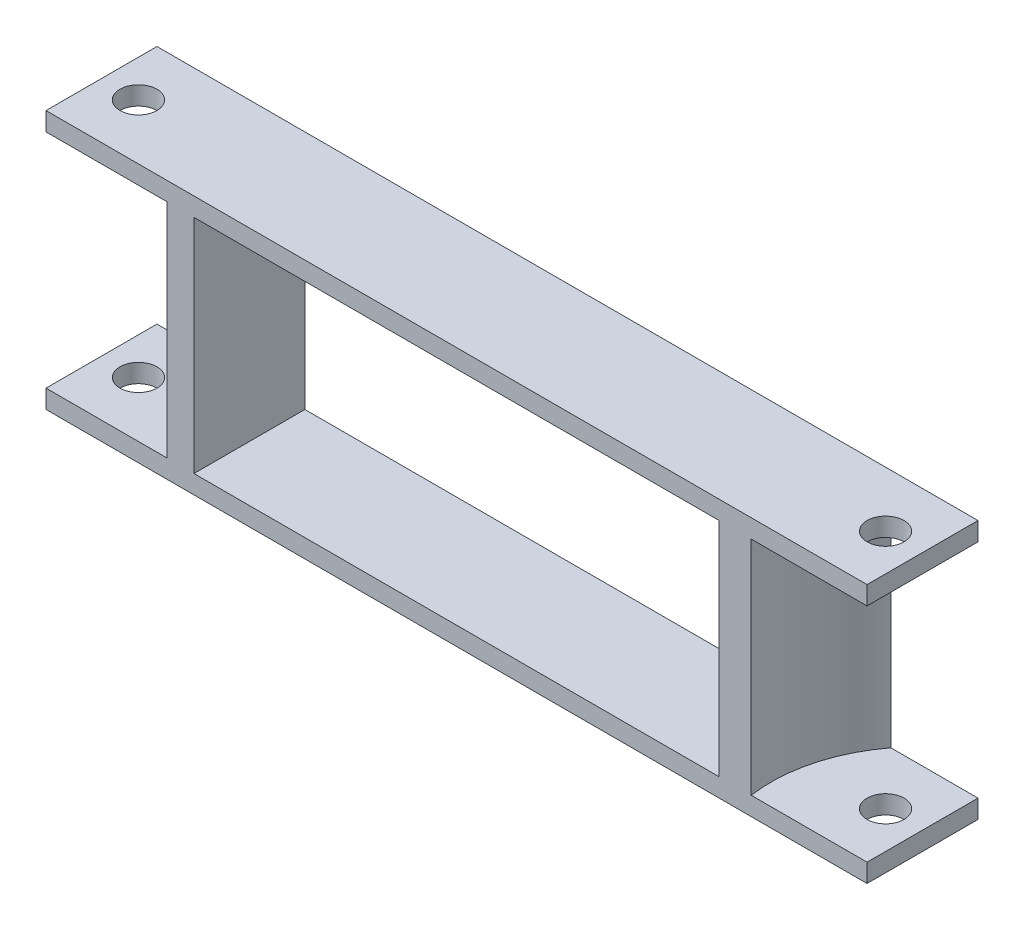
from build123d import *

# Parameters (mm, degrees)
CROQUIS1_W                 = 222
CROQUIS1_H                 = 30
CROQUIS1_R                 = 5
SALIENTE_EXTRUIR1_DEPTH    = 70
CORTAR_EXTRUIR1_DEPTH      = 30
CORTAR_EXTRUIR1_DEPTH_BACK = 30
CROQUIS2_R                 = 40
CROQUIS3_W                 = 142
CROQUIS3_H                 = 60
CORTAR_EXTRUIR2_DEPTH      = 201.889443058


with BuildPart() as part:
    # Croquis1 → Saliente-Extruir1 (new body)
    with BuildSketch(Plane(origin=(0, 0, 0), x_dir=(1, 0, 0), z_dir=(0, 1, 0))):
        with Locations((74.893970672, 3.671875)):
            Rectangle(CROQUIS1_W, CROQUIS1_H)
        with Locations(Location((-26.106029328, 3.671875, 0), (0, 0, 270))):
            Circle(CROQUIS1_R, mode=Mode.SUBTRACT)
        with Locations(Location((175.893970672, 3.671875, 0), (0, 0, 270))):
            Circle(CROQUIS1_R, mode=Mode.SUBTRACT)
    extrude(amount=SALIENTE_EXTRUIR1_DEPTH)

    # Croquis2 → Cortar-Extruir1 (cut, two sides: drawn at the far end of the back side and taken through both)
    with BuildSketch(Plane(origin=(0, 35, 0), x_dir=(-1, 0, 0), z_dir=(0, -1, 0)).offset(-CORTAR_EXTRUIR1_DEPTH_BACK)):
        with Locations((42.379372645, -2.333916419)):
            Circle(CROQUIS2_R)
        with Locations((-194.158036126, -5.581508709)):
            Circle(CROQUIS2_R)
    extrude(amount=CORTAR_EXTRUIR1_DEPTH + CORTAR_EXTRUIR1_DEPTH_BACK, mode=Mode.SUBTRACT)

    # Croquis3 → Cortar-Extruir2 (cut, through all)
    with BuildSketch(Plane.XY.offset(11.328125)):
        with Locations((74.893970672, 35)):
            Rectangle(CROQUIS3_W, CROQUIS3_H)
    extrude(amount=-CORTAR_EXTRUIR2_DEPTH, mode=Mode.SUBTRACT)


solid = part.part
